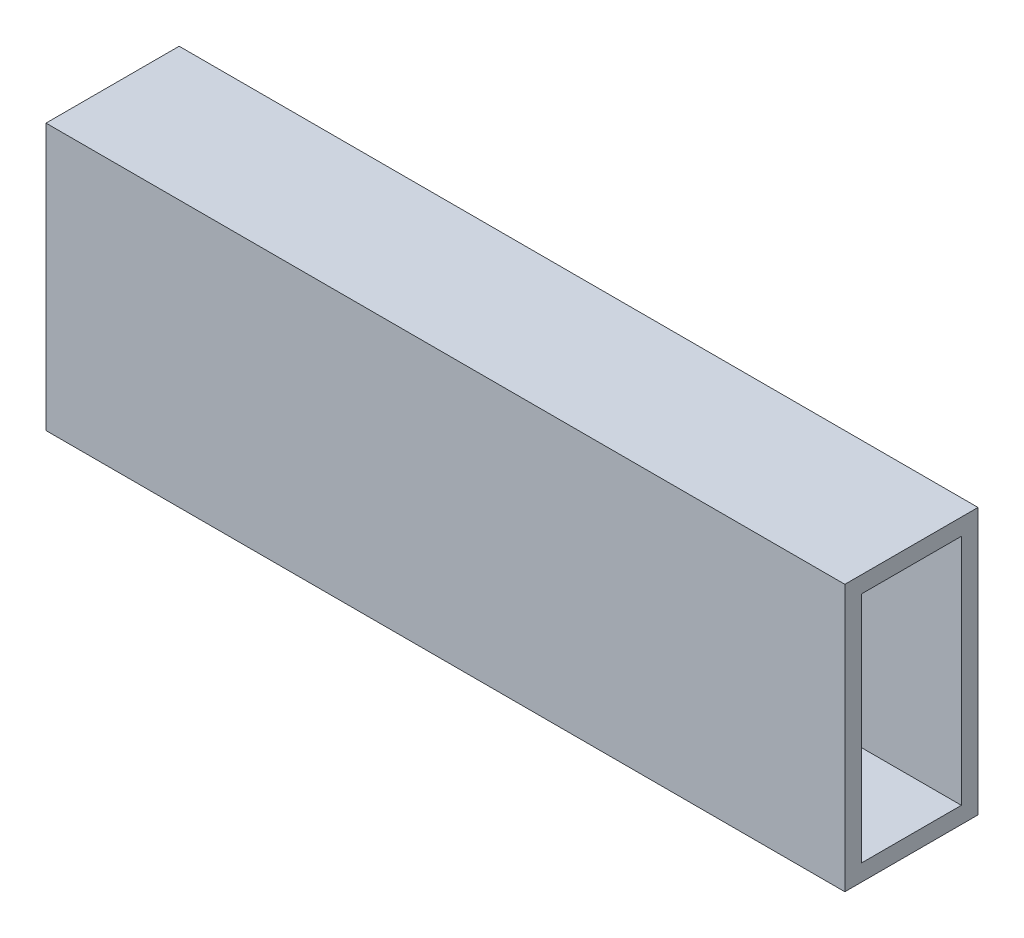
from build123d import *

# Parameters (mm, degrees)
SKETCH1_W           = 25.4
SKETCH1_H           = 50.8
SKETCH1_W_2         = 19.05
SKETCH1_H_2         = 44.45
BOSS_EXTRUDE1_DEPTH = 76.2


with BuildPart() as part:
    # Sketch1 → Boss-Extrude1 (new, symmetric)
    with BuildSketch(Plane(origin=(0, 0, 0), x_dir=(0, 0, -1), z_dir=(1, 0, 0))):
        Rectangle(SKETCH1_W, SKETCH1_H)
        Rectangle(SKETCH1_W_2, SKETCH1_H_2, mode=Mode.SUBTRACT)
    extrude(amount=BOSS_EXTRUDE1_DEPTH, both=True)


solid = part.part
